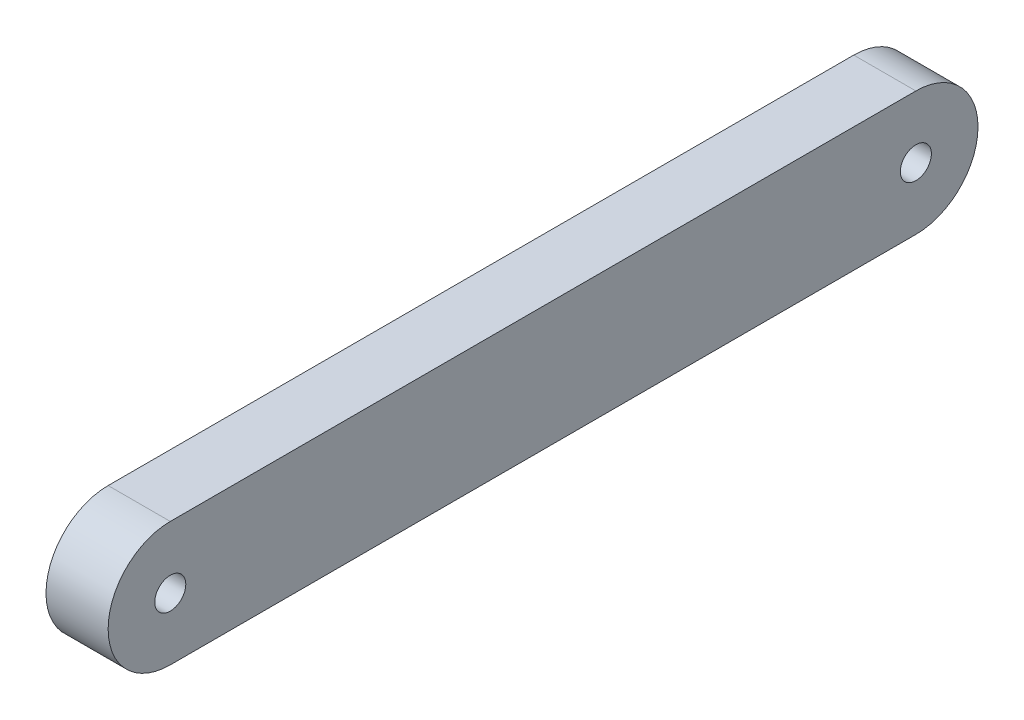
from build123d import *

# Parameters (mm, degrees)
BOSS_EXTRUDE1_DEPTH = 12.7
SKETCH2_R           = 3.175
CUT_EXTRUDE1_DEPTH  = 12.7


with BuildPart() as part:
    # Sketch1 → Boss-Extrude1 (new body)
    with BuildSketch(Plane.YZ):
        with BuildLine():
            Line((-12.7, 0), (-12.7, 152.4))
            ThreePointArc((-12.7, 152.4), (0, 165.1), (12.7, 152.4))
            Line((12.7, 152.4), (12.7, 0))
            ThreePointArc((12.7, 0), (0, -12.7), (-12.7, 0))
        make_face()
    extrude(amount=BOSS_EXTRUDE1_DEPTH)

    # Sketch2 → Cut-Extrude1 (cut)
    with BuildSketch(Plane.YZ.offset(12.7)):
        with Locations(Location((0, 0, 0), (0, 0, 270))):
            Circle(SKETCH2_R)
        with Locations(Location((0, 152.4, 0), (0, 0, 270))):
            Circle(SKETCH2_R)
    extrude(amount=-CUT_EXTRUDE1_DEPTH, mode=Mode.SUBTRACT)


solid = part.part
